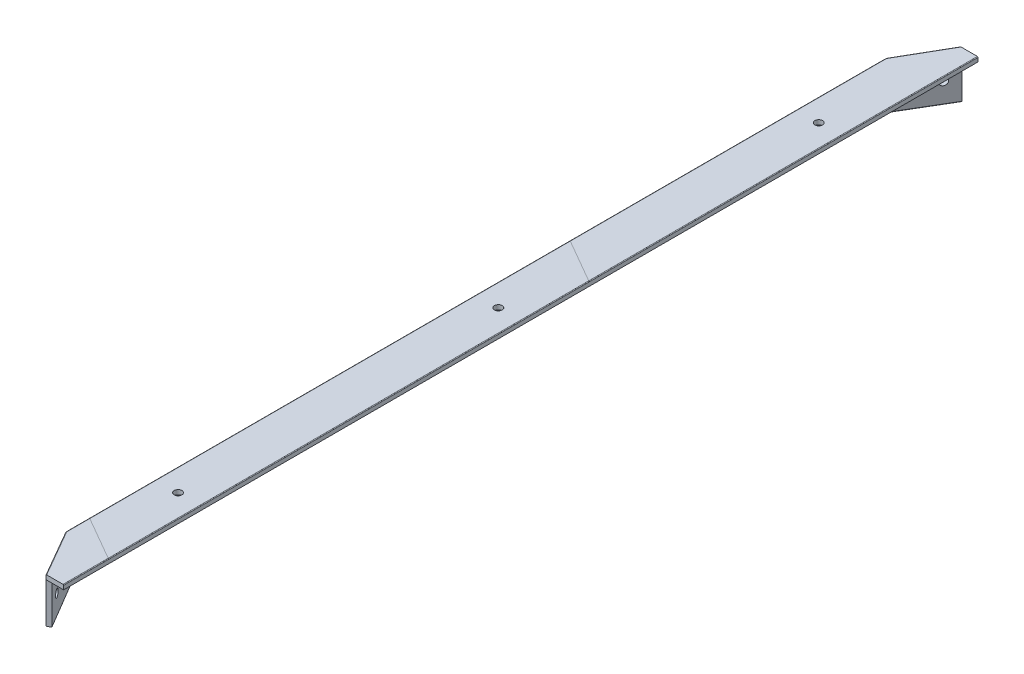
from build123d import *
from build123d.topology import SkipClean

# Parameters (mm, degrees)
BOSS_EXTRUDE1_DEPTH = 640
SKETCH22_R          = 6
CUT_EXTRUDE4_DEPTH  = 10
BOSS_EXTRUDE2_DEPTH = 63
BOSS_EXTRUDE3_DEPTH = 7
SKETCH26_R          = 6
CUT_EXTRUDE5_DEPTH  = 7
FILLET1_R           = 10
FILLET2_R           = 10
FILLET3_R           = 5
FILLET5_R           = 1


with BuildPart() as part:
    # Sketch1 → Boss-Extrude1 (new body)
    with BuildSketch(Plane.XY):
        Polygon((0, 0), (0, 70), (70, 70), (70, 63), (7, 63), (7, 0), align=None)
    extrude(amount=BOSS_EXTRUDE1_DEPTH)

    # Sketch22 → Cut-Extrude4 (cut)
    with BuildSketch(Plane(origin=(0, 70, 0), x_dir=(1, 0, 0), z_dir=(0, 1, 0))):
        with Locations((35, 0)):
            Circle(SKETCH22_R)
        with Locations((35, 500)):
            Circle(SKETCH22_R)
        with Locations(Location((35, -500, 0), (0, 0, 270))):
            Circle(SKETCH22_R)
    extrude(amount=-CUT_EXTRUDE4_DEPTH, mode=Mode.SUBTRACT)

    # Sketch23 → Boss-Extrude2 (add)
    with BuildSketch(Plane(origin=(0, 0, 0), x_dir=(1, 0, 0), z_dir=(0, 1, 0))):
        Polygon((0, -640), (42.5, -713.612159322), (48.562177826, -710.112159322), (7, -640), align=None)
    extrude(amount=BOSS_EXTRUDE2_DEPTH)

    # Sketch25 → Boss-Extrude3 (add)
    with BuildSketch(Plane(origin=(0, 63, 0), x_dir=(1, 0, 0), z_dir=(0, 1, 0))):
        Polygon((70, -640), (0, -640), (42.5, -713.612159322), (70, -713.612159322), align=None)
    extrude(amount=BOSS_EXTRUDE3_DEPTH)

    # Sketch26 → Cut-Extrude5 (cut)
    with BuildSketch(Plane(origin=(-275.556719825, 0, 163.348804279), x_dir=(-0.5099316128113042, 0, -0.8602149442178172), z_dir=(0.8602149442178172, 0, -0.5099316128113042))):
        with Locations((-614.36248118, 31.5)):
            Circle(SKETCH26_R)
        with Locations((-575.367085589, 31.5)):
            Circle(SKETCH26_R)
    extrude(amount=-CUT_EXTRUDE5_DEPTH, mode=Mode.SUBTRACT)

    # Mirror1: part across plane


with BuildPart() as part_1:
    with SkipClean():  # the faces are left unmerged after this step: merging them gives an invalid solid
        add(part.part)
        add(part.part.mirror(Plane.XY))

    # Fillet1
    fillet1_edges = [part_1.edges().sort_by_distance(p)[0] for p in [
        (0, 35, 640),
        (0, 35, -640),
    ]]
    fillet(fillet1_edges, radius=FILLET1_R)

    # Fillet2
    fillet2_edges = [part_1.edges().sort_by_distance(p)[0] for p in [
        (7, 31.5, -640),
        (7, 31.5, 640),
    ]]
    fillet(fillet2_edges, radius=FILLET2_R)

    # Fillet3
    fillet3_edges = [part_1.edges().sort_by_distance(p)[0] for p in [
        (7, 63, 318.629374486),
        (7.355792038, 63, -639.902468471),
        (7.355792038, 63, 639.902468471),
        (28.480014192, 63, 676.235112211),
        (28.480014192, 63, -676.235112211),
    ]]
    fillet(fillet3_edges, radius=FILLET3_R)

    # Fillet5
    fillet5_edges = [part_1.edges().sort_by_distance(p)[0] for p in [
        (0, 70, 318.660254038),
        (0, 0, 318.660254038),
        (70, 70, 356.806079661),
        (21.919872981, 0, -677.966333699),
        (21.919872981, 0, 677.966333699),
        (0.340741737, 0, 639.908698527),
        (0.340741737, 0, -639.908698527),
        (21.919872981, 70, -677.966333699),
        (21.919872981, 70, 677.966333699),
        (0.340741737, 70, 639.908698527),
        (0.340741737, 70, -639.908698527),
        (7, 0, 318.629374486),
        (7.355792038, 0, 639.902468471),
        (7.355792038, 0, -639.902468471),
        (0, 70, 318.660254038),
        (0, 70, -318.660254038),
        (70, 70, 356.806079661),
        (70, 70, -356.806079661),
        (28.480014192, 0, 676.235112211),
        (28.480014192, 0, -676.235112211),
    ]]
    fillet(fillet5_edges, radius=FILLET5_R)


solid = part_1.part
